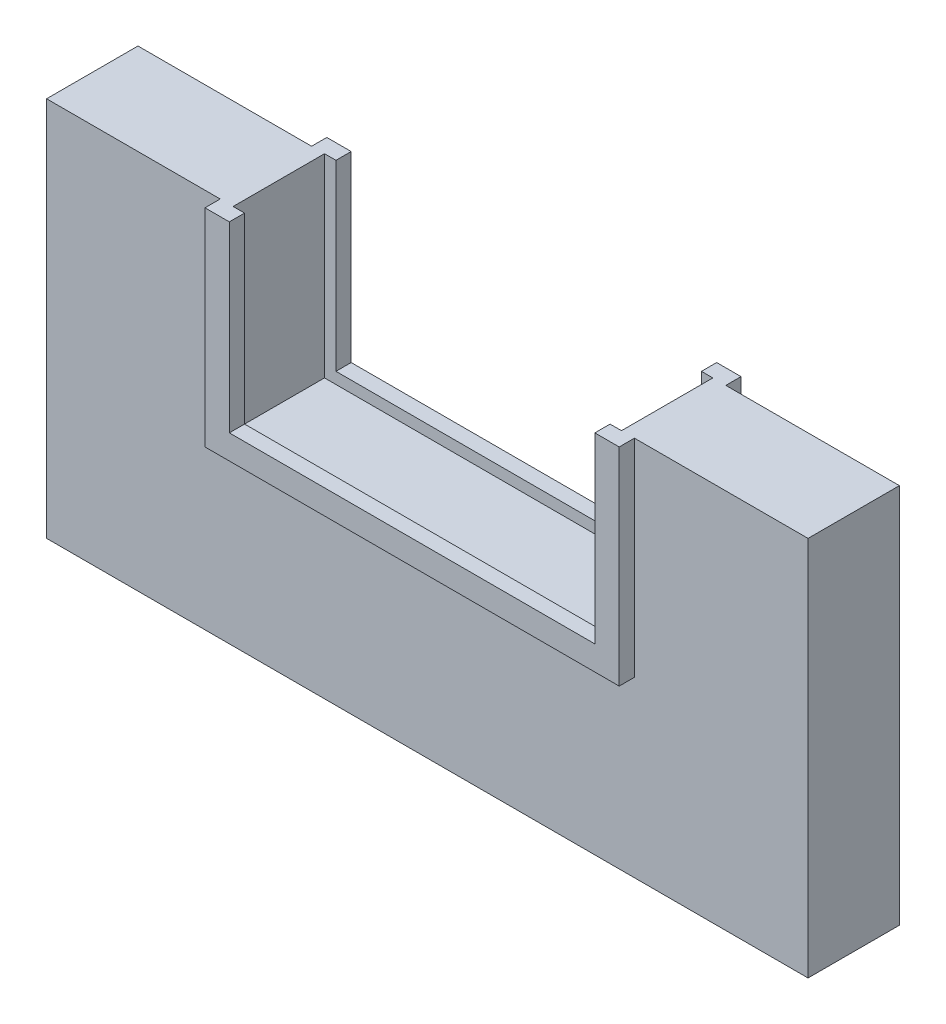
from build123d import *

# Parameters (mm, degrees)
SKETCH1_W           = 25
SKETCH1_H           = 12.5
BOSS_EXTRUDE1_DEPTH = 3
BOSS_EXTRUDE3_START = -1.5
SKETCH2_W           = 13.6
SKETCH2_H           = 6.8
BOSS_EXTRUDE3_DEPTH = 2
CUT_EXTRUDE2_START  = -2
SKETCH4_W           = 12.75
SKETCH4_H           = 6.375
CUT_EXTRUDE2_DEPTH  = 1.5
SKETCH5_W           = 12
SKETCH5_H           = 6
CUT_EXTRUDE3_DEPTH  = 5


with BuildPart() as part:
    # Sketch1 → Boss-Extrude1 (new body)
    with BuildSketch(Plane.XY):
        Rectangle(SKETCH1_W, SKETCH1_H)
    extrude(amount=BOSS_EXTRUDE1_DEPTH)

    # Sketch2 → Boss-Extrude3 (add, symmetric)
    with BuildSketch(Plane.XY.offset(3).offset(BOSS_EXTRUDE3_START)):
        with Locations((0, 2.85)):
            Rectangle(SKETCH2_W, SKETCH2_H)
    extrude(amount=BOSS_EXTRUDE3_DEPTH, both=True)

    # Sketch4 → Cut-Extrude2 (cut, symmetric)
    with BuildSketch(Plane.XY.offset(3.5).offset(CUT_EXTRUDE2_START)):
        with Locations((0, 3.0625)):
            Rectangle(SKETCH4_W, SKETCH4_H)
    extrude(amount=CUT_EXTRUDE2_DEPTH, both=True, mode=Mode.SUBTRACT)

    # Sketch5 → Cut-Extrude3 (cut)
    with BuildSketch(Plane.XY.offset(3.5)):
        with Locations((0, 3.25)):
            Rectangle(SKETCH5_W, SKETCH5_H)
    extrude(amount=-CUT_EXTRUDE3_DEPTH, mode=Mode.SUBTRACT)


solid = part.part
